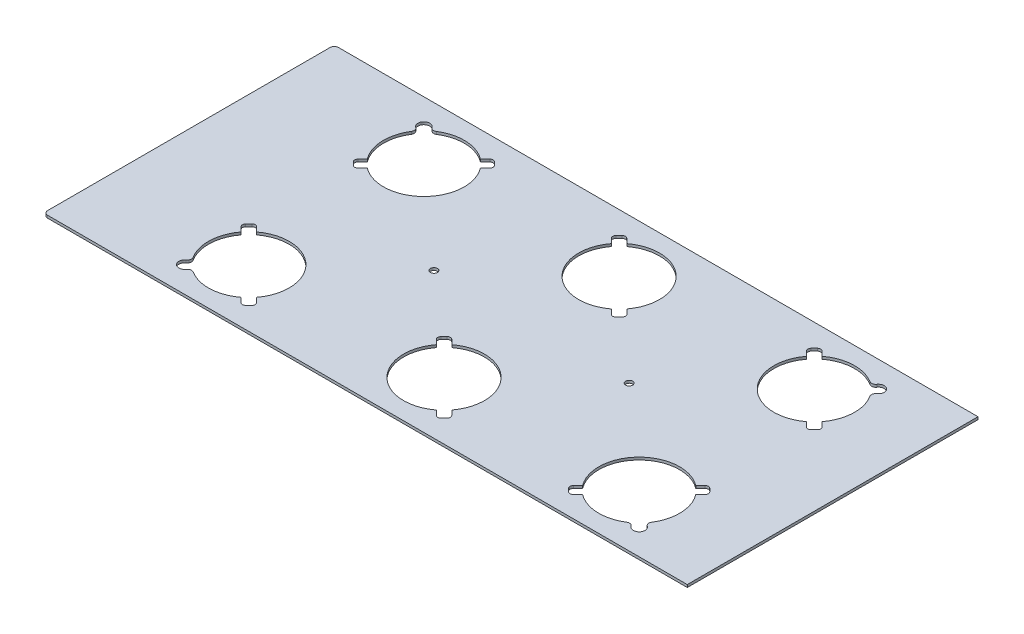
from build123d import *

# Parameters (mm, degrees)
SKETCH1_W                       = 368.3
SKETCH1_H                       = 177.8
BOSS_EXTRUDE1_DEPTH             = 1.5748
SKETCH2_W                       = 177.8
SKETCH2_H                       = 1.5748
BOSS_EXTRUDE2_DEPTH             = 25.4
CUT_EXTRUDE1_DEPTH              = 228.633241191
F_9_32_0_28125_DIAMETER_HOLE1_D = 7.14375
FILLET1_R                       = 2.54
F_8_CLEARANCE_HOLE1_D           = 4.3053


with BuildPart() as part:
    # Sketch1 → Boss-Extrude1 (new body)
    with BuildSketch(Plane(origin=(0, 0, 0), x_dir=(1, 0, 0), z_dir=(0, 1, 0))):
        Rectangle(SKETCH1_W, SKETCH1_H)
    extrude(amount=BOSS_EXTRUDE1_DEPTH)

    # Sketch2 → Boss-Extrude2 (add)
    with BuildSketch(Plane.ZY.offset(184.15)):
        with Locations((0, 0.7874)):
            Rectangle(SKETCH2_W, SKETCH2_H)
    extrude(amount=BOSS_EXTRUDE2_DEPTH)

    # Sketch3 → Cut-Extrude1 (cut, through all)
    with BuildSketch(Plane.XZ):
        with BuildLine():
            Line((141.91869864, -35.729416794), (139.054032394, -38.59408304))
            ThreePointArc((139.054032394, -38.59408304), (136.846598155, -70.997098155), (104.44358304, -73.204532394))
            Line((104.44358304, -73.204532394), (101.578916794, -76.06919864))
            ThreePointArc((101.578916794, -76.06919864), (100.164703231, -76.654985078), (98.750489669, -76.06919864))
            Line((98.750489669, -76.06919864), (96.84130136, -74.160010331))
            ThreePointArc((96.84130136, -74.160010331), (96.255514922, -72.745796769), (96.84130136, -71.331583206))
            Line((96.84130136, -71.331583206), (99.705967606, -68.46691696))
            ThreePointArc((99.705967606, -68.46691696), (101.913401845, -36.063901845), (134.31641696, -33.856467606))
            Line((134.31641696, -33.856467606), (137.181083206, -30.99180136))
            ThreePointArc((137.181083206, -30.99180136), (138.595296769, -30.406014922), (140.009510331, -30.99180136))
            Line((140.009510331, -30.99180136), (141.91869864, -32.900989669))
            ThreePointArc((141.91869864, -32.900989669), (142.504485078, -34.315203231), (141.91869864, -35.729416794))
        make_face()
        with BuildLine():
            Line((22.53869864, -35.729416794), (19.674032394, -38.59408304))
            ThreePointArc((19.674032394, -38.59408304), (17.466598155, -70.997098155), (-14.93641696, -73.204532394))
            Line((-14.93641696, -73.204532394), (-17.801083206, -76.06919864))
            ThreePointArc((-17.801083206, -76.06919864), (-19.215296769, -76.654985078), (-20.629510331, -76.06919864))
            Line((-20.629510331, -76.06919864), (-22.53869864, -74.160010331))
            ThreePointArc((-22.53869864, -74.160010331), (-23.124485078, -72.745796769), (-22.53869864, -71.331583206))
            Line((-22.53869864, -71.331583206), (-19.674032394, -68.46691696))
            ThreePointArc((-19.674032394, -68.46691696), (-17.466598155, -36.063901845), (14.93641696, -33.856467606))
            Line((14.93641696, -33.856467606), (17.801083206, -30.99180136))
            ThreePointArc((17.801083206, -30.99180136), (19.215296769, -30.406014922), (20.629510331, -30.99180136))
            Line((20.629510331, -30.99180136), (22.53869864, -32.900989669))
            ThreePointArc((22.53869864, -32.900989669), (23.124485078, -34.315203231), (22.53869864, -35.729416794))
        make_face()
        with BuildLine():
            Line((-137.181083206, -30.99180136), (-134.31641696, -33.856467606))
            ThreePointArc((-134.31641696, -33.856467606), (-101.913401845, -36.063901845), (-99.705967606, -68.46691696))
            Line((-99.705967606, -68.46691696), (-96.84130136, -71.331583206))
            ThreePointArc((-96.84130136, -71.331583206), (-96.255514922, -72.745796769), (-96.84130136, -74.160010331))
            Line((-96.84130136, -74.160010331), (-98.750489669, -76.06919864))
            ThreePointArc((-98.750489669, -76.06919864), (-100.164703231, -76.654985078), (-101.578916794, -76.06919864))
            Line((-101.578916794, -76.06919864), (-104.44358304, -73.204532394))
            ThreePointArc((-104.44358304, -73.204532394), (-136.846598155, -70.997098155), (-139.054032394, -38.59408304))
            Line((-139.054032394, -38.59408304), (-141.91869864, -35.729416794))
            ThreePointArc((-141.91869864, -35.729416794), (-142.504485078, -34.315203231), (-141.91869864, -32.900989669))
            Line((-141.91869864, -32.900989669), (-140.009510331, -30.99180136))
            ThreePointArc((-140.009510331, -30.99180136), (-138.595296769, -30.406014922), (-137.181083206, -30.99180136))
        make_face()
        with BuildLine():
            Line((-134.31641696, 33.856467606), (-137.181083206, 30.99180136))
            ThreePointArc((-137.181083206, 30.99180136), (-138.595296769, 30.406014922), (-140.009510331, 30.99180136))
            Line((-140.009510331, 30.99180136), (-141.91869864, 32.900989669))
            ThreePointArc((-141.91869864, 32.900989669), (-142.504485078, 34.315203231), (-141.91869864, 35.729416794))
            Line((-141.91869864, 35.729416794), (-139.054032394, 38.59408304))
            ThreePointArc((-139.054032394, 38.59408304), (-136.846598155, 70.997098155), (-104.44358304, 73.204532394))
            Line((-104.44358304, 73.204532394), (-101.578916794, 76.06919864))
            ThreePointArc((-101.578916794, 76.06919864), (-100.164703231, 76.654985078), (-98.750489669, 76.06919864))
            Line((-98.750489669, 76.06919864), (-96.84130136, 74.160010331))
            ThreePointArc((-96.84130136, 74.160010331), (-96.255514922, 72.745796769), (-96.84130136, 71.331583206))
            Line((-96.84130136, 71.331583206), (-99.705967606, 68.46691696))
            ThreePointArc((-99.705967606, 68.46691696), (-101.913401845, 36.063901845), (-134.31641696, 33.856467606))
        make_face()
        with BuildLine():
            Line((14.93641696, 73.204532394), (17.801083206, 76.06919864))
            ThreePointArc((17.801083206, 76.06919864), (19.215296769, 76.654985078), (20.629510331, 76.06919864))
            Line((20.629510331, 76.06919864), (22.53869864, 74.160010331))
            ThreePointArc((22.53869864, 74.160010331), (23.124485078, 72.745796769), (22.53869864, 71.331583206))
            Line((22.53869864, 71.331583206), (19.674032394, 68.46691696))
            ThreePointArc((19.674032394, 68.46691696), (17.466598155, 36.063901845), (-14.93641696, 33.856467606))
            Line((-14.93641696, 33.856467606), (-17.801083206, 30.99180136))
            ThreePointArc((-17.801083206, 30.99180136), (-19.215296769, 30.406014922), (-20.629510331, 30.99180136))
            Line((-20.629510331, 30.99180136), (-22.53869864, 32.900989669))
            ThreePointArc((-22.53869864, 32.900989669), (-23.124485078, 34.315203231), (-22.53869864, 35.729416794))
            Line((-22.53869864, 35.729416794), (-19.674032394, 38.59408304))
            ThreePointArc((-19.674032394, 38.59408304), (-17.466598155, 70.997098155), (14.93641696, 73.204532394))
        make_face()
        with BuildLine():
            Line((101.578916794, 76.06919864), (104.44358304, 73.204532394))
            ThreePointArc((104.44358304, 73.204532394), (136.846598155, 70.997098155), (139.054032394, 38.59408304))
            Line((139.054032394, 38.59408304), (141.91869864, 35.729416794))
            ThreePointArc((141.91869864, 35.729416794), (142.504485078, 34.315203231), (141.91869864, 32.900989669))
            Line((141.91869864, 32.900989669), (140.009510331, 30.99180136))
            ThreePointArc((140.009510331, 30.99180136), (138.595296769, 30.406014922), (137.181083206, 30.99180136))
            Line((137.181083206, 30.99180136), (134.31641696, 33.856467606))
            ThreePointArc((134.31641696, 33.856467606), (101.913401845, 36.063901845), (99.705967606, 68.46691696))
            Line((99.705967606, 68.46691696), (96.84130136, 71.331583206))
            ThreePointArc((96.84130136, 71.331583206), (96.255514922, 72.745796769), (96.84130136, 74.160010331))
            Line((96.84130136, 74.160010331), (98.750489669, 76.06919864))
            ThreePointArc((98.750489669, 76.06919864), (100.164703231, 76.654985078), (101.578916794, 76.06919864))
        make_face()
    extrude(amount=-CUT_EXTRUDE1_DEPTH, mode=Mode.SUBTRACT)

    # 9/32 (0.28125) Diameter Hole1 (through all)
    with Locations(Plane(origin=(0, 0, 0), x_dir=(-1, 0, 0), z_dir=(0, -1, 0))):
        with Locations((-139.0015, 73.152), (139.0015, 73.152), (139.0015, -73.152), (-139.0015, -73.152)):
            Hole(F_9_32_0_28125_DIAMETER_HOLE1_D / 2)

    # Fillet1
    fillet1_edges = [part.edges().sort_by_distance(p)[0] for p in [
        (-209.55, 0.7874, 88.9),
        (-209.55, 0.7874, -88.9),
        (138.04454174, 0.7874, 69.710703456),
        (135.560203456, 0.7874, 72.19504174),
        (-135.560203456, 0.7874, 72.19504174),
        (-138.04454174, 0.7874, 69.710703456),
        (-138.04454174, 0.7874, -69.710703456),
        (-135.560203456, 0.7874, -72.19504174),
        (135.560203456, 0.7874, -72.19504174),
        (138.04454174, 0.7874, -69.710703456),
    ]]
    fillet(fillet1_edges, radius=FILLET1_R)

    # #8 Clearance Hole1 (through all)
    with Locations(Plane(origin=(0, 0, 0), x_dir=(-1, 0, 0), z_dir=(0, -1, 0))):
        with Locations((-59.69, 0), (59.69, 0)):
            Hole(F_8_CLEARANCE_HOLE1_D / 2)


solid = part.part
